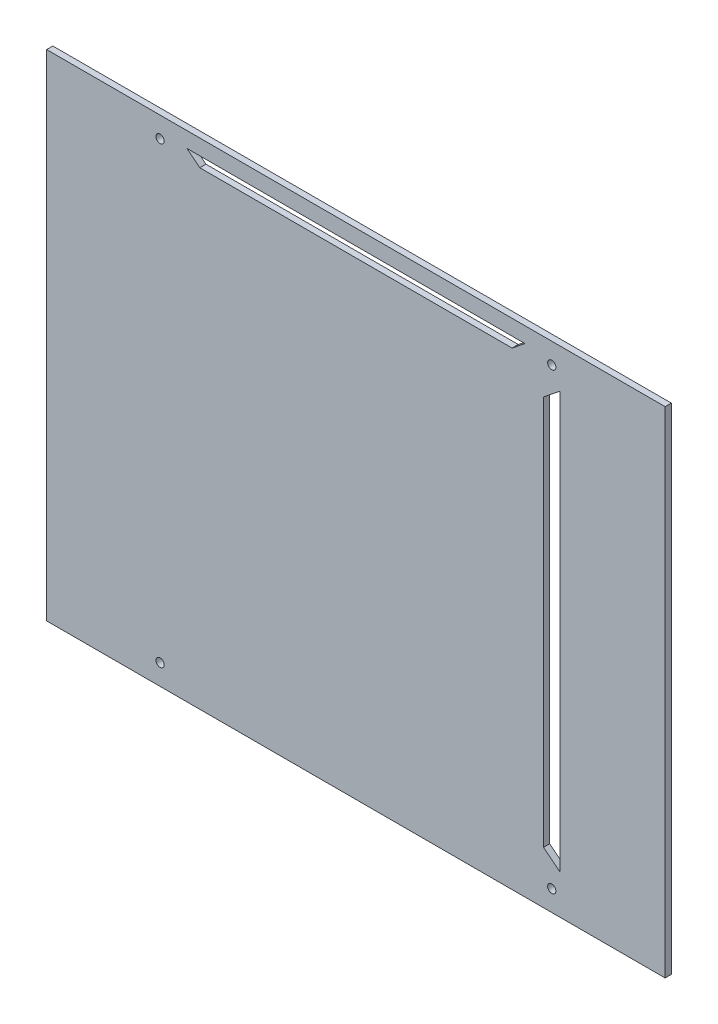
from build123d import *

# Parameters (mm, degrees)
SKETCH1_W           = 300
SKETCH1_H           = 240
SKETCH1_R           = 2
BOSS_EXTRUDE1_DEPTH = 3


with BuildPart() as part:
    # Sketch1 → Boss-Extrude1 (new body)
    with BuildSketch(Plane.XY):
        Rectangle(SKETCH1_W, SKETCH1_H)
        with Locations((-95, 110)):
            Circle(SKETCH1_R, mode=Mode.SUBTRACT)
        with Locations((95, 110)):
            Circle(SKETCH1_R, mode=Mode.SUBTRACT)
        with Locations(Location((95, -110, 0), (0, 0, 180))):
            Circle(SKETCH1_R, mode=Mode.SUBTRACT)
        with Locations(Location((-95, -110, 0), (0, 0, 180))):
            Circle(SKETCH1_R, mode=Mode.SUBTRACT)
        Polygon((99, 101), (99, -101), (91, -94.6), (91, 94.6), align=None, mode=Mode.SUBTRACT)
        Polygon((82, 112.5), (-82, 112.5), (-75.75, 107.5), (75.75, 107.5), align=None, mode=Mode.SUBTRACT)
    extrude(amount=BOSS_EXTRUDE1_DEPTH)


solid = part.part
